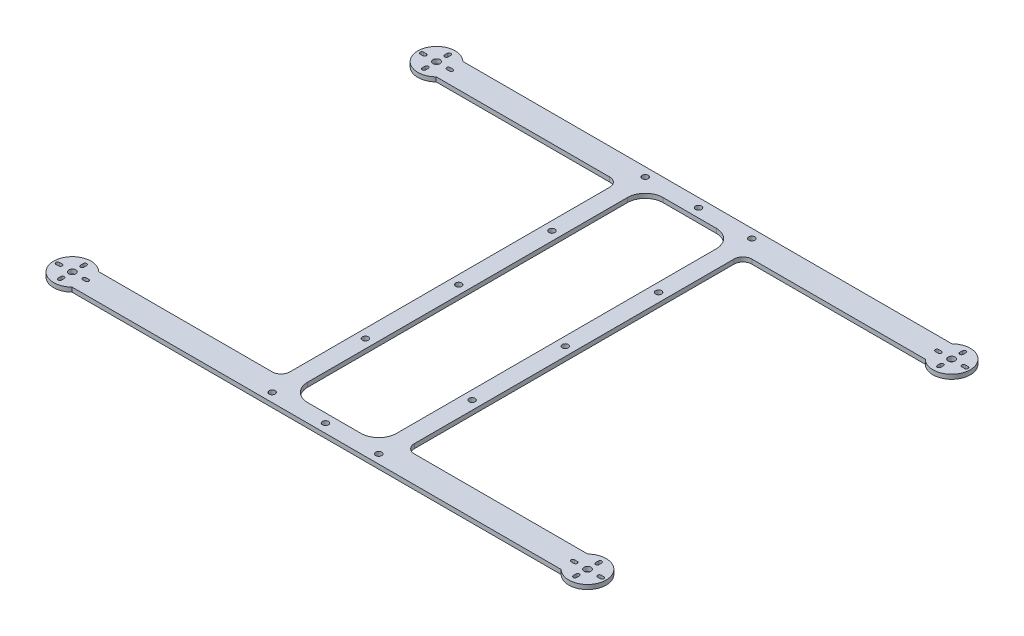
from build123d import *

# Parameters (mm, degrees)
SKETCH1_W           = 63.5
SKETCH1_H           = 254
BOSS_EXTRUDE1_DEPTH = 3.175
SKETCH4_R           = 13.335
BOSS_EXTRUDE4_DEPTH = 3.175
SKETCH5_R           = 2.5
MOTOR_HOLES_DEPTH   = 245.142429639
SKETCH7_R           = 2.159
CUT_EXTRUDE2_DEPTH  = 245.142429639
FILLET1_R           = 12.7
FILLET2_R           = 6.35


with BuildPart() as part:
    # Sketch1 → Boss-Extrude1 (new body)
    with BuildSketch(Plane(origin=(0, 0, 0), x_dir=(1, 0, 0), z_dir=(0, 1, 0))):
        Polygon((-44.45, 139.7), (44.45, 139.7), (184.15, 139.7), (184.15, 120.65), (44.45, 120.65), (44.45, -120.65), (184.15, -120.65), (184.15, -139.7), (44.45, -139.7), (-44.45, -139.7), (-184.15, -139.7), (-184.15, -120.65), (-44.45, -120.65), (-44.45, 120.65), (-184.15, 120.65), (-184.15, 139.7), align=None)
        Rectangle(SKETCH1_W, SKETCH1_H, mode=Mode.SUBTRACT)
    extrude(amount=BOSS_EXTRUDE1_DEPTH)

    # Sketch4 → Boss-Extrude4 (add)
    with BuildSketch(Plane(origin=(0, 3.175, 0), x_dir=(1, 0, 0), z_dir=(0, 1, 0))):
        with Locations((184.15, 130.175)):
            Circle(SKETCH4_R)
        with Locations((-184.15, 130.175)):
            Circle(SKETCH4_R)
        with Locations((-184.15, -130.175)):
            Circle(SKETCH4_R)
        with Locations((184.15, -130.175)):
            Circle(SKETCH4_R)
    extrude(amount=-BOSS_EXTRUDE4_DEPTH)

    # Sketch5 → Motor Holes (cut, through all)
    with BuildSketch(Plane(origin=(0, 3.175, 0), x_dir=(1, 0, 0), z_dir=(0, 1, 0))):
        with Locations(Location((184.15, 130.175, 0), (0, 0, 270))):
            Circle(SKETCH5_R)
        with Locations(Location((-184.15, 130.175, 0), (0, 0, 90))):
            Circle(SKETCH5_R)
        with Locations(Location((184.15, -130.175, 0), (0, 0, 90))):
            Circle(SKETCH5_R)
        with Locations(Location((-184.15, -130.175, 0), (0, 0, 270))):
            Circle(SKETCH5_R)
        with BuildLine():
            Line((173.650002, 131.425), (175.649998, 131.425))
            ThreePointArc((175.649998, 131.425), (176.899998, 130.175), (175.649998, 128.925))
            Line((175.649998, 128.925), (173.650002, 128.925))
            ThreePointArc((173.650002, 128.925), (172.400002, 130.175), (173.650002, 131.425))
        make_face()
        with BuildLine():
            Line((194.649998, 131.425), (192.650002, 131.425))
            ThreePointArc((192.650002, 131.425), (191.400002, 130.175), (192.650002, 128.925))
            Line((192.650002, 128.925), (194.649998, 128.925))
            ThreePointArc((194.649998, 128.925), (195.899998, 130.175), (194.649998, 131.425))
        make_face()
        with BuildLine():
            Line((185.4, 139.175), (185.4, 137.175))
            ThreePointArc((185.4, 137.175), (184.15, 135.925), (182.9, 137.175))
            Line((182.9, 137.175), (182.9, 139.175))
            ThreePointArc((182.9, 139.175), (184.15, 140.425), (185.4, 139.175))
        make_face()
        with BuildLine():
            Line((185.4, 121.175), (185.4, 123.175))
            ThreePointArc((185.4, 123.175), (184.15, 124.425), (182.9, 123.175))
            Line((182.9, 123.175), (182.9, 121.175))
            ThreePointArc((182.9, 121.175), (184.15, 119.925), (185.4, 121.175))
        make_face()
        with BuildLine():
            Line((-173.650002, 131.425), (-175.649998, 131.425))
            ThreePointArc((-175.649998, 131.425), (-176.899998, 130.175), (-175.649998, 128.925))
            Line((-175.649998, 128.925), (-173.650002, 128.925))
            ThreePointArc((-173.650002, 128.925), (-172.400002, 130.175), (-173.650002, 131.425))
        make_face()
        with BuildLine():
            Line((-194.649998, 131.425), (-192.650002, 131.425))
            ThreePointArc((-192.650002, 131.425), (-191.400002, 130.175), (-192.650002, 128.925))
            Line((-192.650002, 128.925), (-194.649998, 128.925))
            ThreePointArc((-194.649998, 128.925), (-195.899998, 130.175), (-194.649998, 131.425))
        make_face()
        with BuildLine():
            Line((-185.4, 139.175), (-185.4, 137.175))
            ThreePointArc((-185.4, 137.175), (-184.15, 135.925), (-182.9, 137.175))
            Line((-182.9, 137.175), (-182.9, 139.175))
            ThreePointArc((-182.9, 139.175), (-184.15, 140.425), (-185.4, 139.175))
        make_face()
        with BuildLine():
            Line((-185.4, 121.175), (-185.4, 123.175))
            ThreePointArc((-185.4, 123.175), (-184.15, 124.425), (-182.9, 123.175))
            Line((-182.9, 123.175), (-182.9, 121.175))
            ThreePointArc((-182.9, 121.175), (-184.15, 119.925), (-185.4, 121.175))
        make_face()
        with BuildLine():
            Line((173.650002, -131.425), (175.649998, -131.425))
            ThreePointArc((175.649998, -131.425), (176.899998, -130.175), (175.649998, -128.925))
            Line((175.649998, -128.925), (173.650002, -128.925))
            ThreePointArc((173.650002, -128.925), (172.400002, -130.175), (173.650002, -131.425))
        make_face()
        with BuildLine():
            Line((185.4, -139.175), (185.4, -137.175))
            ThreePointArc((185.4, -137.175), (184.15, -135.925), (182.9, -137.175))
            Line((182.9, -137.175), (182.9, -139.175))
            ThreePointArc((182.9, -139.175), (184.15, -140.425), (185.4, -139.175))
        make_face()
        with BuildLine():
            Line((194.649998, -131.425), (192.650002, -131.425))
            ThreePointArc((192.650002, -131.425), (191.400002, -130.175), (192.650002, -128.925))
            Line((192.650002, -128.925), (194.649998, -128.925))
            ThreePointArc((194.649998, -128.925), (195.899998, -130.175), (194.649998, -131.425))
        make_face()
        with BuildLine():
            Line((185.4, -121.175), (185.4, -123.175))
            ThreePointArc((185.4, -123.175), (184.15, -124.425), (182.9, -123.175))
            Line((182.9, -123.175), (182.9, -121.175))
            ThreePointArc((182.9, -121.175), (184.15, -119.925), (185.4, -121.175))
        make_face()
        with BuildLine():
            Line((-185.4, -121.175), (-185.4, -123.175))
            ThreePointArc((-185.4, -123.175), (-184.15, -124.425), (-182.9, -123.175))
            Line((-182.9, -123.175), (-182.9, -121.175))
            ThreePointArc((-182.9, -121.175), (-184.15, -119.925), (-185.4, -121.175))
        make_face()
        with BuildLine():
            Line((-185.4, -139.175), (-185.4, -137.175))
            ThreePointArc((-185.4, -137.175), (-184.15, -135.925), (-182.9, -137.175))
            Line((-182.9, -137.175), (-182.9, -139.175))
            ThreePointArc((-182.9, -139.175), (-184.15, -140.425), (-185.4, -139.175))
        make_face()
        with BuildLine():
            Line((-194.649998, -131.425), (-192.650002, -131.425))
            ThreePointArc((-192.650002, -131.425), (-191.400002, -130.175), (-192.650002, -128.925))
            Line((-192.650002, -128.925), (-194.649998, -128.925))
            ThreePointArc((-194.649998, -128.925), (-195.899998, -130.175), (-194.649998, -131.425))
        make_face()
        with BuildLine():
            Line((-173.650002, -131.425), (-175.649998, -131.425))
            ThreePointArc((-175.649998, -131.425), (-176.899998, -130.175), (-175.649998, -128.925))
            Line((-175.649998, -128.925), (-173.650002, -128.925))
            ThreePointArc((-173.650002, -128.925), (-172.400002, -130.175), (-173.650002, -131.425))
        make_face()
    extrude(amount=-MOTOR_HOLES_DEPTH, mode=Mode.SUBTRACT)

    # Sketch7 → Cut-Extrude2 (cut, through all)
    with BuildSketch(Plane(origin=(0, 3.175, 0), x_dir=(1, 0, 0), z_dir=(0, 1, 0))):
        with Locations(Location((-38.1, 133.35, 0), (0, 0, 270))):
            Circle(SKETCH7_R)
        with Locations(Location((-38.1, 66.675, 0), (0, 0, 270))):
            Circle(SKETCH7_R)
        with Locations(Location((-38.1, 0, 0), (0, 0, 270))):
            Circle(SKETCH7_R)
        with Locations(Location((-38.1, -66.675, 0), (0, 0, 270))):
            Circle(SKETCH7_R)
        with Locations(Location((-38.1, -133.35, 0), (0, 0, 270))):
            Circle(SKETCH7_R)
        with Locations(Location((38.1, -133.35, 0), (0, 0, 90))):
            Circle(SKETCH7_R)
        with Locations(Location((38.1, -66.675, 0), (0, 0, 90))):
            Circle(SKETCH7_R)
        with Locations(Location((38.1, 0, 0), (0, 0, 90))):
            Circle(SKETCH7_R)
        with Locations(Location((38.1, 66.675, 0), (0, 0, 90))):
            Circle(SKETCH7_R)
        with Locations(Location((38.1, 133.35, 0), (0, 0, 90))):
            Circle(SKETCH7_R)
        with Locations(Location((0, 133.35, 0), (0, 0, 270))):
            Circle(SKETCH7_R)
        with Locations(Location((0, -133.35, 0), (0, 0, 90))):
            Circle(SKETCH7_R)
    extrude(amount=-CUT_EXTRUDE2_DEPTH, mode=Mode.SUBTRACT)

    # Fillet1
    fillet1_edges = [part.edges().sort_by_distance(p)[0] for p in [
        (-31.75, 1.5875, -127),
        (-31.75, 1.5875, 127),
        (31.75, 1.5875, 127),
        (31.75, 1.5875, -127),
    ]]
    fillet(fillet1_edges, radius=FILLET1_R)

    # Fillet2
    fillet2_edges = [part.edges().sort_by_distance(p)[0] for p in [
        (44.45, 1.5875, -120.65),
        (44.45, 1.5875, 120.65),
        (-44.45, 1.5875, 120.65),
        (-44.45, 1.5875, -120.65),
    ]]
    fillet(fillet2_edges, radius=FILLET2_R)


solid = part.part
